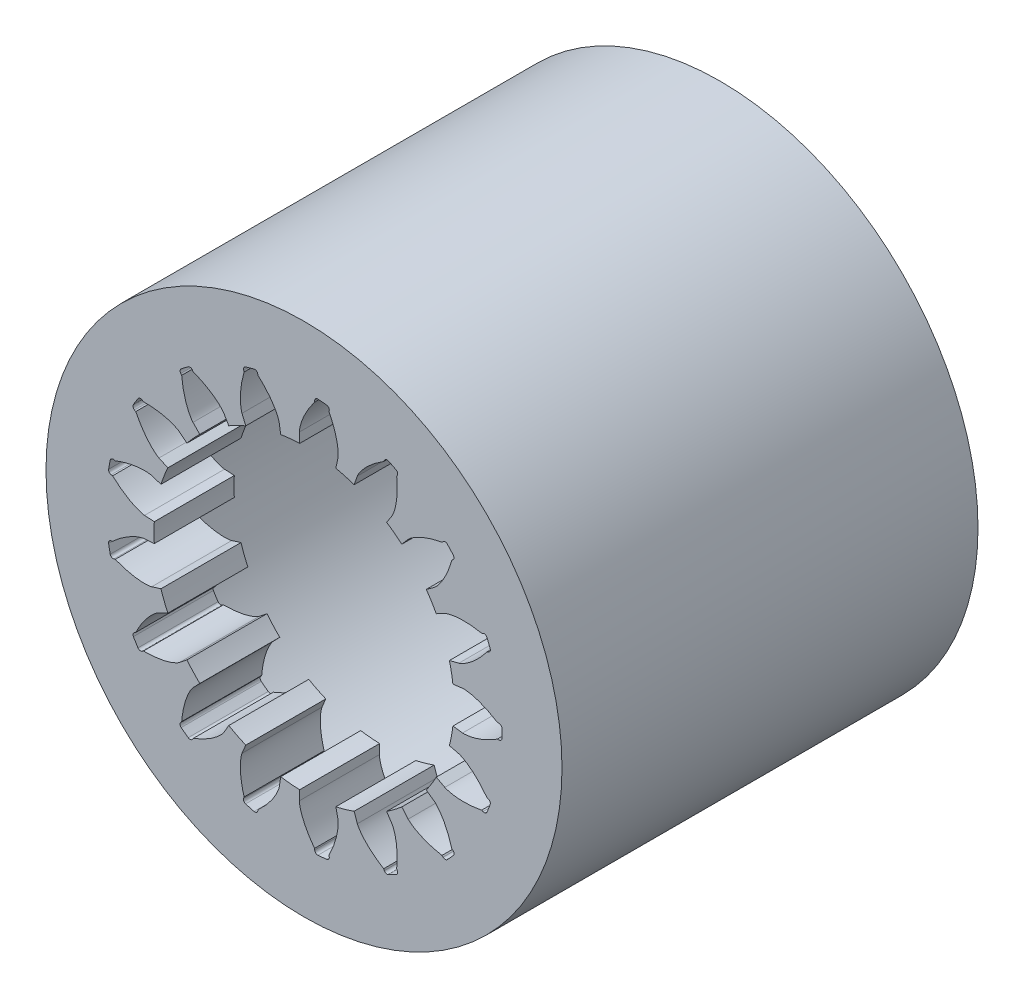
from build123d import *

# Parameters (mm, degrees)
BLANK_SKETCH_R    = 16.125
BLANK_SKETCH_R_2  = 9.375
BLANK_DEPTH       = 26
TOOTH_SPACE_DEPTH = 35.583684737
TEETH_COUNT       = 17
RELIEF_SKETCH_R   = 13
RELIEF_BORE_DEPTH = 8


with BuildPart() as part:
    # Blank Sketch → Blank (new body)
    with BuildSketch(Plane.XY):
        with Locations(Location((0, 0, 0), (0, 0, 180))):
            Circle(BLANK_SKETCH_R)
        with Locations(Location((0, 0, 0), (0, 0, 180))):
            Circle(BLANK_SKETCH_R_2, mode=Mode.SUBTRACT)
    extrude(amount=BLANK_DEPTH)

    # Tooth Space Sketch → Tooth Space (cut, symmetric)
    with BuildSketch(Plane.XY):
        with BuildLine():
            Line((9.910724412, 1.209327135), (8.065179068, 0.984129867))
            Line((8.065179068, 0.984129867), (8.065179068, -0.984129867))
            Line((8.065179068, -0.984129867), (9.910724412, -1.209327135))
            add(Edge.make_bspline(
                [(9.910724412, -1.209327135), (9.914153719, -1.209695343), (9.923788325, -1.21057447), (9.942063727, -1.211629542), (9.97194961, -1.212487268), (10.01010811, -1.21230964), (10.059488302, -1.210619912), (10.117706229, -1.206751472), (10.18169804, -1.200533125), (10.251292172, -1.191646935), (10.320668976, -1.180907813), (10.389797391, -1.16845363), (10.458571, -1.154478092), (10.541741717, -1.135699151), (10.641262416, -1.110611321), (10.75720108, -1.077557516), (10.888175907, -1.035677343), (11.020995853, -0.988325198), (11.151107035, -0.937901196), (11.281787599, -0.882584125), (11.407668104, -0.825966225), (11.537490921, -0.762724708), (11.656861054, -0.702090057), (11.789450054, -0.629298269), (11.89612538, -0.569131012), (12.005282841, -0.502960826), (12.058253481, -0.470164404), (12.085257112, -0.453155152)],
                knots=[0, 0, 0, 0, 0, 0.005376749, 0.015083688, 0.02853182, 0.04661014, 0.064854849, 0.092110525, 0.119476176, 0.146842496, 0.174208854, 0.201574956, 0.228941013, 0.256307345, 0.307035032, 0.361767352, 0.416499661, 0.471231937, 0.525964282, 0.580696616, 0.635428982, 0.690161387, 0.744893688, 0.799626082, 0.854358408, 0.909090915, 0.909090915, 0.909090915, 0.909090915, 0.909090915], degree=4))
            Line((12.085257112, -0.453155152), (12.177499896, -0.456613936))
            ThreePointArc((12.177499896, -0.456613936), (12.313100701, -0.405717886), (12.371979796, -0.273387849))
            ThreePointArc((12.371979796, -0.273387849), (12.375, 0), (12.371979796, 0.273387849))
            ThreePointArc((12.371979796, 0.273387849), (12.313100701, 0.405717886), (12.177499896, 0.456613936))
            Line((12.177499896, 0.456613936), (12.085257112, 0.453155152))
            add(Edge.make_bspline(
                [(9.910724412, 1.209327135), (9.914153719, 1.209695343), (9.923788325, 1.21057447), (9.942063727, 1.211629542), (9.97194961, 1.212487268), (10.01010811, 1.21230964), (10.059488302, 1.210619912), (10.117706229, 1.206751472), (10.18169804, 1.200533125), (10.251292172, 1.191646935), (10.320668976, 1.180907813), (10.389797391, 1.16845363), (10.458571, 1.154478092), (10.541741717, 1.135699151), (10.641262416, 1.110611321), (10.75720108, 1.077557516), (10.888175907, 1.035677343), (11.020995853, 0.988325198), (11.151107035, 0.937901196), (11.281787599, 0.882584125), (11.407668104, 0.825966225), (11.537490921, 0.762724708), (11.656861054, 0.702090057), (11.789450054, 0.629298269), (11.89612538, 0.569131012), (12.005282841, 0.502960826), (12.058253481, 0.470164404), (12.085257112, 0.453155152)],
                knots=[0, 0, 0, 0, 0, 0.005376749, 0.015083688, 0.02853182, 0.04661014, 0.064854849, 0.092110525, 0.119476176, 0.146842496, 0.174208854, 0.201574956, 0.228941013, 0.256307345, 0.307035032, 0.361767352, 0.416499661, 0.471231937, 0.525964282, 0.580696616, 0.635428982, 0.690161387, 0.744893688, 0.799626082, 0.854358408, 0.909090915, 0.909090915, 0.909090915, 0.909090915, 0.909090915], degree=4))
        make_face()
    tooth_space = extrude(amount=TOOTH_SPACE_DEPTH, both=True, mode=Mode.SUBTRACT)

    # Teeth: Tooth Space ×17 about axis
    teeth_axis = Axis((0, 0, -1.30007105), (0, 0, 1))
    for i in range(1, TEETH_COUNT):
        add(tooth_space.rotate(teeth_axis, i * 360 / TEETH_COUNT), mode=Mode.SUBTRACT)

    # Relief Sketch → Relief Bore (cut, symmetric)
    with BuildSketch(Plane.XY.offset(13)):
        Circle(RELIEF_SKETCH_R)
    extrude(amount=RELIEF_BORE_DEPTH, both=True, mode=Mode.SUBTRACT)


solid = part.part
